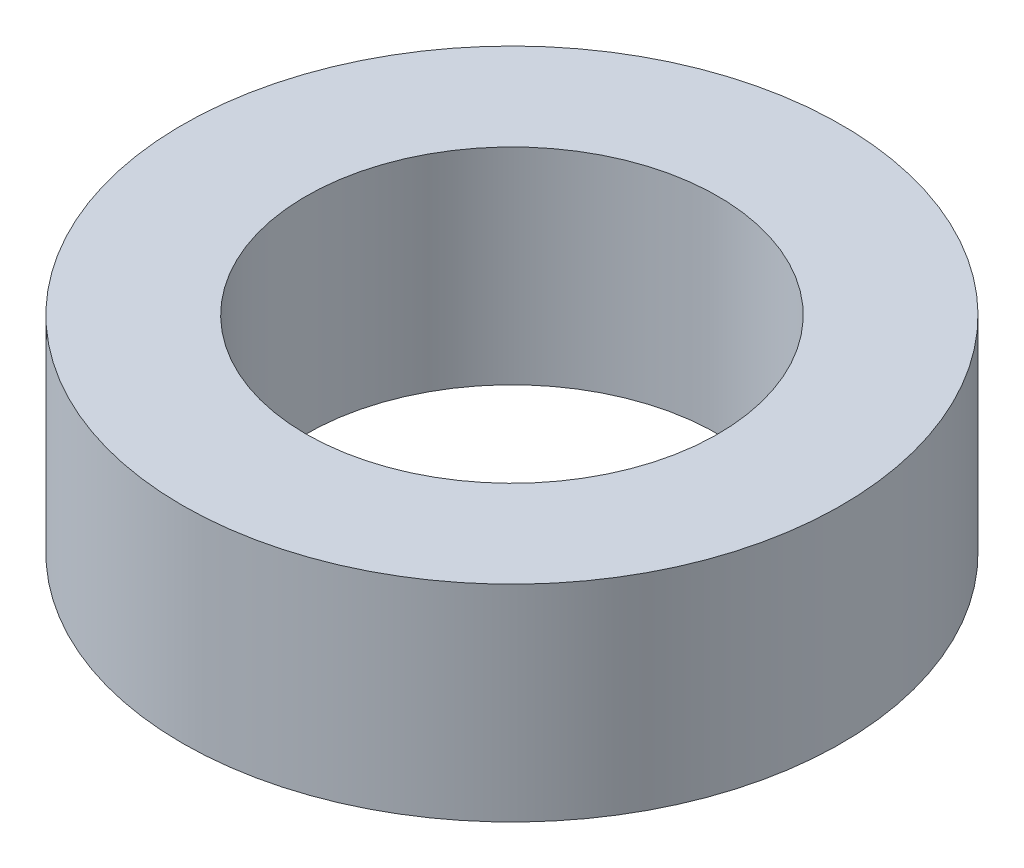
from build123d import *

# Parameters (mm, degrees)
SKETCH1_R           = 5.08
SKETCH1_R_2         = 3.175
BOSS_EXTRUDE1_DEPTH = 3.175


with BuildPart() as part:
    # Sketch1 → Boss-Extrude1 (new body)
    with BuildSketch(Plane(origin=(0, 0, 0), x_dir=(1, 0, 0), z_dir=(0, 1, 0))):
        with Locations(Location((0, 0, 0), (0, 0, 270))):
            Circle(SKETCH1_R)
        with Locations(Location((0, 0, 0), (0, 0, 270))):
            Circle(SKETCH1_R_2, mode=Mode.SUBTRACT)
    extrude(amount=BOSS_EXTRUDE1_DEPTH)


solid = part.part
